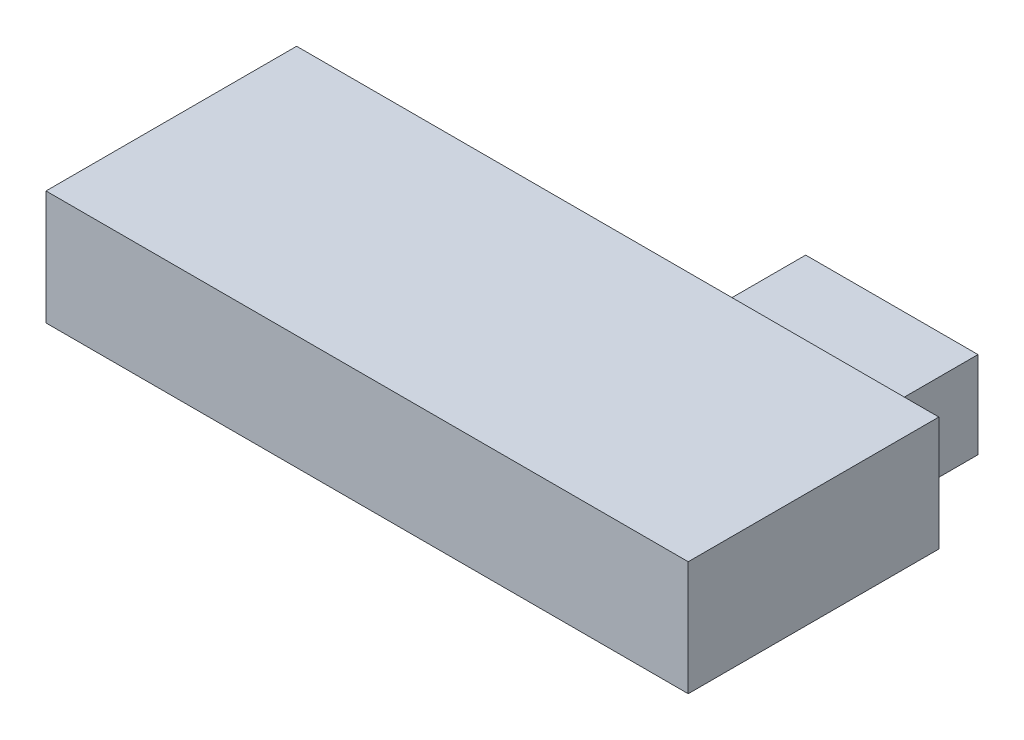
from build123d import *

# Parameters (mm, degrees)
SKETCH_1_W      = 41
SKETCH_1_H      = 16
EXTRUDE_1_DEPTH = 7.3
SKETCH_2_W      = 11
SKETCH_2_H      = 5.539220632
EXTRUDE_2_DEPTH = 5.5


with BuildPart() as part:
    # 草图1 → 凸台-拉伸1 (new body)
    with BuildSketch(Plane(origin=(0, 0, 0), x_dir=(1, 0, 0), z_dir=(0, 1, 0))):
        with Locations((20.5, 8)):
            Rectangle(SKETCH_1_W, SKETCH_1_H)
    extrude(amount=EXTRUDE_1_DEPTH)

    # 草图2 → 凸台-拉伸2 (add)
    with BuildSketch(Plane(origin=(0, 0, -16), x_dir=(-1, 0, 0), z_dir=(0, 0, -1))):
        with Locations((-32.5, 3.734568254)):
            Rectangle(SKETCH_2_W, SKETCH_2_H)
    extrude(amount=EXTRUDE_2_DEPTH)


solid = part.part
